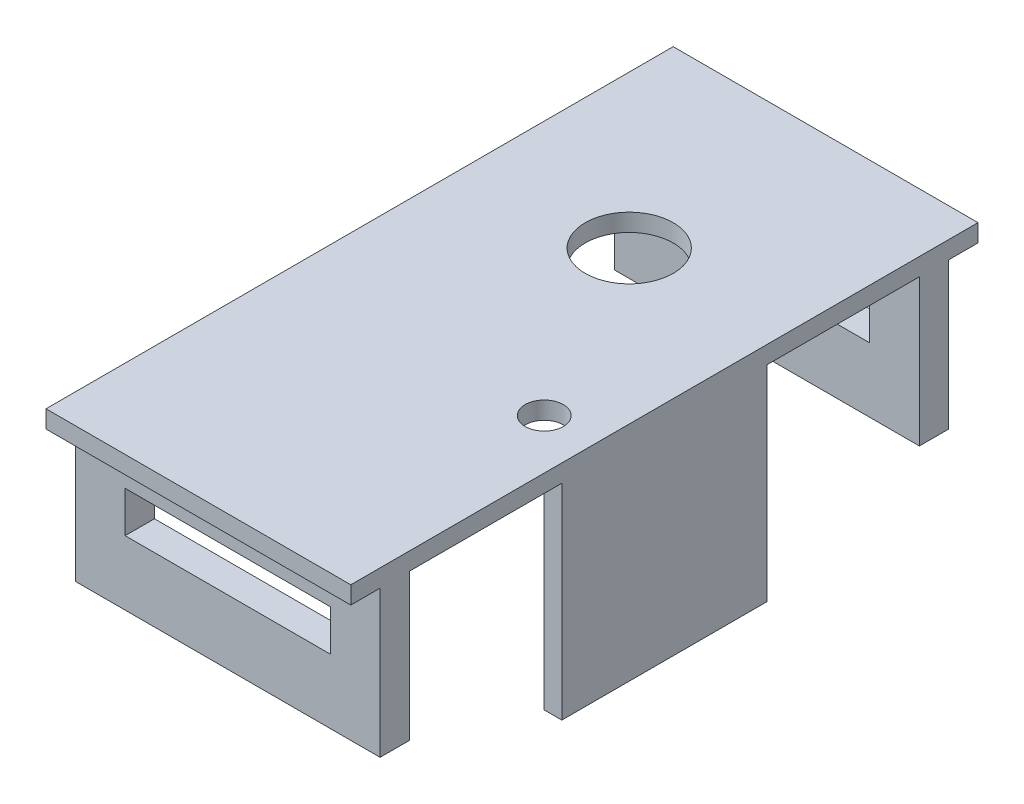
from build123d import *

# Parameters (mm, degrees)
SKETCH1_W               = 52
SKETCH1_H               = 107
SKETCH1_R               = 3.25
BOSS_EXTRUDE1_DEPTH     = 3
SKETCH2_W               = 3
SKETCH2_H               = 35
BOSS_EXTRUDE2_DEPTH     = 35
SKETCH3_W               = 52
SKETCH3_H               = 5
BOSS_EXTRUDE3_DEPTH     = 25
SKETCH4_R               = 7.5
CUT_EXTRUDE1_DEPTH      = 71.585055075
CUT_EXTRUDE2_DEPTH      = 111.927904515
CUT_EXTRUDE2_DEPTH_BACK = 111.927904515
SKETCH5_W               = 35
SKETCH5_H               = 7


with BuildPart() as part:
    # Sketch1 → Boss-Extrude1 (new body)
    with BuildSketch(Plane(origin=(0, 0, 0), x_dir=(1, 0, 0), z_dir=(0, 1, 0))):
        Rectangle(SKETCH1_W, SKETCH1_H)
        with Locations(Location((17.5, -12, 0), (0, 0, 270))):
            Circle(SKETCH1_R, mode=Mode.SUBTRACT)
    extrude(amount=BOSS_EXTRUDE1_DEPTH)

    # Sketch2 → Boss-Extrude2 (add)
    with BuildSketch(Plane.XZ):
        with Locations((-24.5, 0)):
            Rectangle(SKETCH2_W, SKETCH2_H)
        with Locations((24.5, 0)):
            Rectangle(SKETCH2_W, SKETCH2_H)
    extrude(amount=BOSS_EXTRUDE2_DEPTH)

    # Sketch3 → Boss-Extrude3 (add)
    with BuildSketch(Plane.XZ):
        with Locations((0, 46)):
            Rectangle(SKETCH3_W, SKETCH3_H)
        with Locations((0, -46)):
            Rectangle(SKETCH3_W, SKETCH3_H)
    extrude(amount=BOSS_EXTRUDE3_DEPTH)

    # Sketch4 → Cut-Extrude1 (cut, through all)
    with BuildSketch(Plane(origin=(0, 3, 0), x_dir=(1, 0, 0), z_dir=(0, 1, 0))):
        with Locations(Location((0, 20, 0), (0, 0, 270))):
            Circle(SKETCH4_R)
    extrude(amount=-CUT_EXTRUDE1_DEPTH, mode=Mode.SUBTRACT)

    # Sketch5 → Cut-Extrude2 (cut, two sides: drawn at the far end of the back side and taken through both)
    with BuildSketch(Plane(origin=(0, 0, -48.5), x_dir=(-1, 0, 0), z_dir=(0, 0, -1)).offset(-CUT_EXTRUDE2_DEPTH_BACK)):
        with Locations((0, -10.5)):
            Rectangle(SKETCH5_W, SKETCH5_H)
    extrude(amount=CUT_EXTRUDE2_DEPTH + CUT_EXTRUDE2_DEPTH_BACK, mode=Mode.SUBTRACT)


solid = part.part
